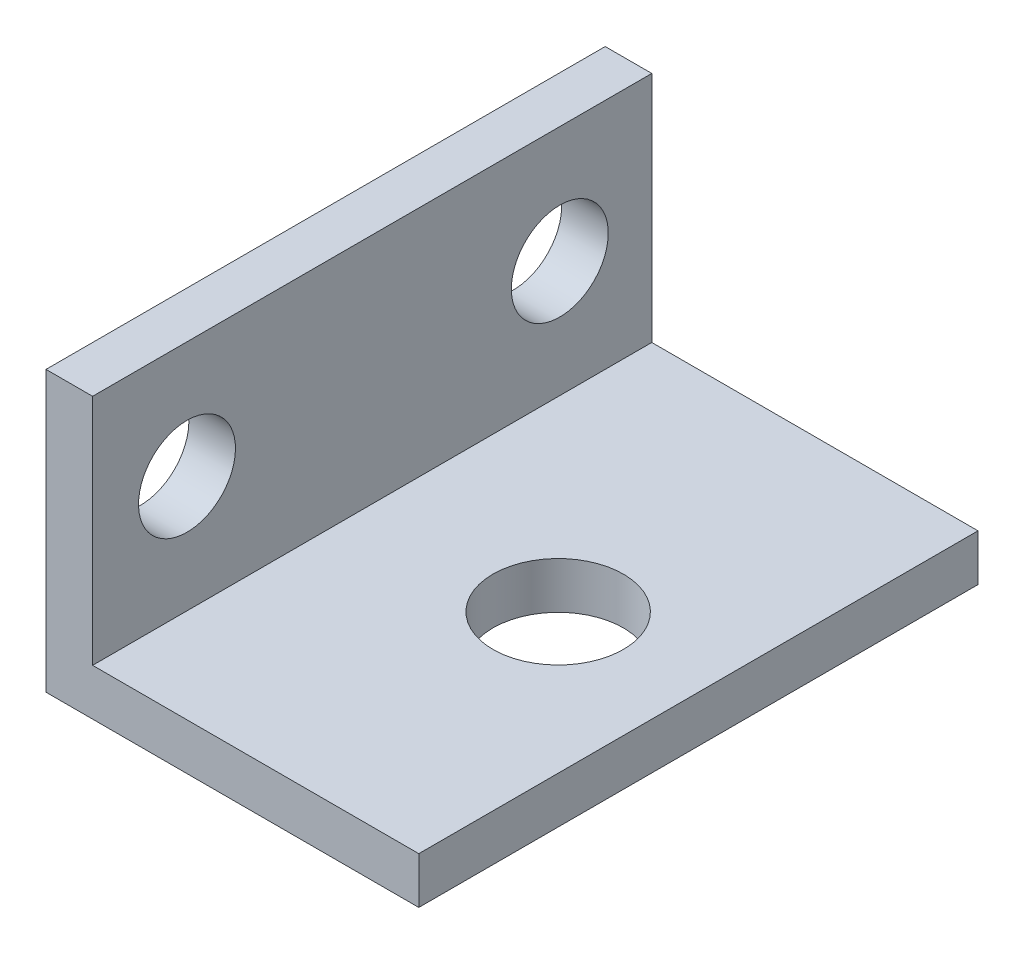
from build123d import *

# Parameters (mm, degrees)
BOSS_EXTRUDE2_DEPTH     = 38.1
CUT_EXTRUDE1_DEPTH      = 46.800854849
CUT_EXTRUDE1_DEPTH_BACK = 46.800854849
SKETCH2_R               = 4.445
CUT_EXTRUDE3_DEPTH      = 47.878313216
CUT_EXTRUDE3_DEPTH_BACK = 47.878313216
SKETCH3_R               = 3.302


with BuildPart() as part:
    # Sketch1 → Boss-Extrude2 (new body)
    with BuildSketch(Plane.XY):
        Polygon((-5.548232323, 15.875), (-5.548232323, -3.175), (19.851767677, -3.175), (19.851767677, 0), (-2.373232323, 0), (-2.373232323, 15.875), align=None)
    extrude(amount=BOSS_EXTRUDE2_DEPTH)

    # Sketch2 → Cut-Extrude1 (cut, two sides: drawn at the far end of the back side and taken through both)
    with BuildSketch(Plane(origin=(0, 0, 0), x_dir=(1, 0, 0), z_dir=(0, 1, 0)).offset(-CUT_EXTRUDE1_DEPTH_BACK)):
        with Locations(Location((10.326767677, -19.078550513, 0), (0, 0, 180))):
            Circle(SKETCH2_R)
    extrude(amount=CUT_EXTRUDE1_DEPTH + CUT_EXTRUDE1_DEPTH_BACK, mode=Mode.SUBTRACT)

    # Sketch3 → Cut-Extrude3 (cut, two sides: drawn at the far end of the back side and taken through both)
    with BuildSketch(Plane(origin=(-2.373232323, 0, 0), x_dir=(0, 0, -1), z_dir=(1, 0, 0)).offset(-CUT_EXTRUDE3_DEPTH_BACK)):
        with Locations(Location((-6.269326955, 7.9375, 0), (0, 0, 90))):
            Circle(SKETCH3_R)
        with Locations(Location((-31.669326955, 7.9375, 0), (0, 0, 90))):
            Circle(SKETCH3_R)
    extrude(amount=CUT_EXTRUDE3_DEPTH + CUT_EXTRUDE3_DEPTH_BACK, mode=Mode.SUBTRACT)


solid = part.part
